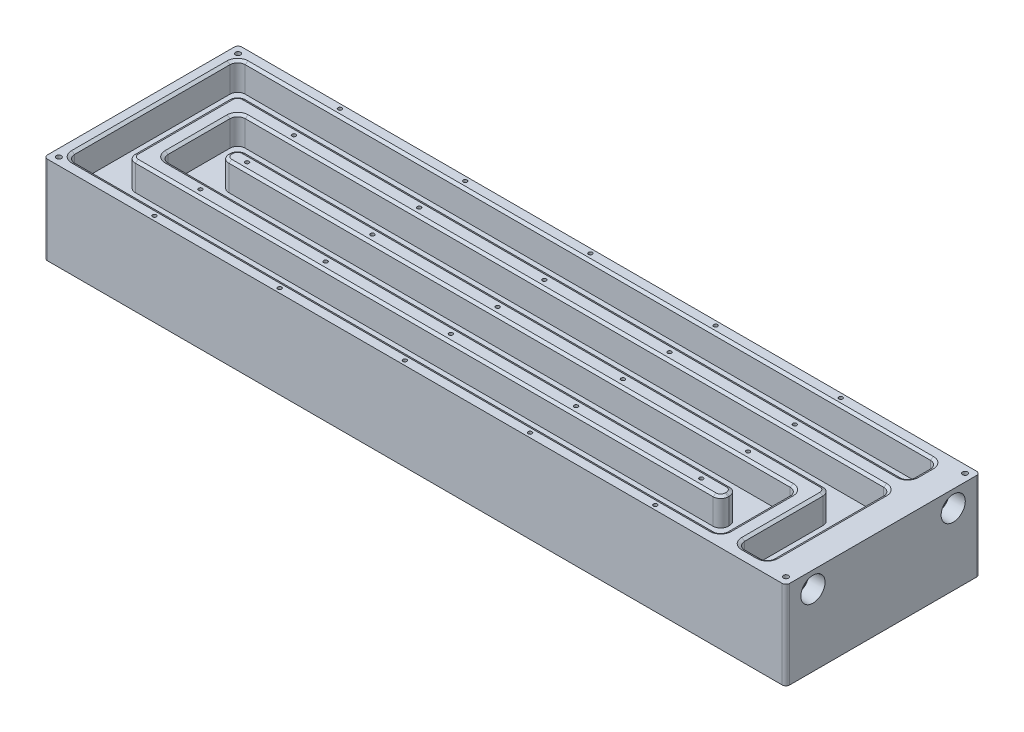
from build123d import *

# Parameters (mm, degrees)
SKETCH1_W                                  = 488.95
SKETCH1_H                                  = 134
BOSS_EXTRUDE1_DEPTH                        = 58
F_3_8_NPT_TAPPED_HOLE1_AT_2_COUNT          = 2
F_3_8_NPT_TAPPED_HOLE1_AT_2_PITCH          = 92.4
SKETCH4_W                                  = 461.45
SKETCH4_H                                  = 20
CUT_EXTRUDE1_DEPTH                         = 18
LPATTERN1_COUNT                            = 4
LPATTERN1_PITCH                            = 30.8
BOSS_EXTRUDE2_REACH                        = 262.04
SKETCH5_W                                  = 30.8
SKETCH5_H                                  = 20
BOSS_EXTRUDE3_REACH                        = 262.04
SKETCH6_W                                  = 30.8
SKETCH6_H                                  = 20
SKETCH7_W                                  = 20
SKETCH7_H                                  = 61.6
CUT_EXTRUDE2_DEPTH                         = 18
SKETCH8_W                                  = 20
SKETCH8_H                                  = 10.8
CUT_EXTRUDE3_DEPTH                         = 18
SKETCH9_W                                  = 20
SKETCH9_H                                  = 72.4
CUT_EXTRUDE4_DEPTH                         = 18
SKETCH10_W                                 = 20
SKETCH10_H                                 = 10.8
CUT_EXTRUDE5_DEPTH                         = 18
FILLET1_R                                  = 5
CHAMFER1_SIZE                              = 2
CHAMFER1_SIZE2                             = 1.154700538
TAP_DRILL_FOR_M3X0_5_PLATE_NEXT_MO_2_COUNT = 2
TAP_DRILL_FOR_M3X0_5_PLATE_NEXT_MO_2_PITCH = 61.6
LPATTERN2_COUNT                            = 5
LPATTERN2_PITCH                            = 97.75
SKETCH15_W                                 = 488.95
SKETCH15_H                                 = 3
CUT_EXTRUDE6_DEPTH                         = 261.040430751
SKETCH16_W                                 = 488.95
SKETCH16_H                                 = 3
CUT_EXTRUDE7_DEPTH                         = 261.040430751
FILLET2_R                                  = 2.5
TAP_DRILL_FOR_M3X0_5_TAP1_AT_2_COUNT       = 2
TAP_DRILL_FOR_M3X0_5_TAP1_AT_2_PITCH       = 30.8
TAP_DRILL_FOR_M3X0_5_TAP1_AT_3_COUNT       = 2
TAP_DRILL_FOR_M3X0_5_TAP1_AT_3_PITCH       = 61.1
TAP_DRILL_FOR_M3X0_5_TAP1_AT_4_COUNT       = 2
TAP_DRILL_FOR_M3X0_5_TAP1_AT_4_PITCH       = 30.8
TAP_DRILL_FOR_M3X0_5_TAP1_AT_5_COUNT       = 2
TAP_DRILL_FOR_M3X0_5_TAP1_AT_5_PITCH       = 61.1
LPATTERN3_COUNT                            = 5
LPATTERN3_PITCH                            = 82.5
TAP_DRILL_FOR_M4X0_7_TAP1_D                = 3.3
TAP_DRILL_FOR_M4X0_7_TAP1_DEPTH            = 17.38
TAP_DRILL_FOR_M4X0_7_TAP1_TIP              = 0.991420021


with BuildPart() as part:
    # Sketch1 → Boss-Extrude1 (new body)
    with BuildSketch(Plane(origin=(0, 0, 0), x_dir=(1, 0, 0), z_dir=(0, 1, 0))):
        Rectangle(SKETCH1_W, SKETCH1_H)
    extrude(amount=BOSS_EXTRUDE1_DEPTH)

    # Sketch3 → 3/8 NPT Tapped Hole1 (revolve, cut)
    with BuildSketch(Plane(origin=(244.475, 47, 46.2), x_dir=(0, 0, -1), z_dir=(0, 1, 0))):
        Polygon((0, 0), (0, 21.668582582), (7.1374, 17.38), (7.1374, 10.33), (7.653732966, 10.33), (7.963027, 0), align=None)
    f_3_8_npt_tapped_hole1 = revolve(axis=Axis((250.825, 47, 46.2), (-1, 0, 0)), mode=Mode.SUBTRACT)

    # 3/8 NPT Tapped Hole1 at 2: 3/8 NPT Tapped Hole1 ×2
    with Locations(*[(0, 0, -i * F_3_8_NPT_TAPPED_HOLE1_AT_2_PITCH) for i in range(1, F_3_8_NPT_TAPPED_HOLE1_AT_2_COUNT)]):
        add(f_3_8_npt_tapped_hole1, mode=Mode.SUBTRACT)

    # Sketch4 → Cut-Extrude1 (cut)
    with BuildSketch(Plane(origin=(0, 58, 0), x_dir=(1, 0, 0), z_dir=(0, 1, 0))):
        with Locations((-6.25, 46.2)):
            Rectangle(SKETCH4_W, SKETCH4_H)
    cut_extrude1 = extrude(amount=-CUT_EXTRUDE1_DEPTH, mode=Mode.SUBTRACT)

    # LPattern1: Cut-Extrude1 ×4
    with Locations(*[(0, 0, i * LPATTERN1_PITCH) for i in range(1, LPATTERN1_COUNT)]):
        add(cut_extrude1, mode=Mode.SUBTRACT)

    # Sketch5 → Boss-Extrude2 (add, up to next)
    with BuildSketch(Plane(origin=(0, 58, 0), x_dir=(1, 0, 0), z_dir=(0, 1, 0)), mode=Mode.PRIVATE) as boss_extrude2_sk1:
        with Locations((-221.575, -15.4)):
            Rectangle(SKETCH5_W, SKETCH5_H)
    boss_extrude2_tool1 = extrude(boss_extrude2_sk1.sketch, amount=-BOSS_EXTRUDE2_REACH, mode=Mode.PRIVATE) - part.part
    # Sketch5 → Boss-Extrude2 (add, up to next)
    with BuildSketch(Plane(origin=(0, 58, 0), x_dir=(1, 0, 0), z_dir=(0, 1, 0)), mode=Mode.PRIVATE) as boss_extrude2_sk2:
        with Locations((-221.575, 15.4)):
            Rectangle(SKETCH5_W, SKETCH5_H)
    boss_extrude2_tool2 = extrude(boss_extrude2_sk2.sketch, amount=-BOSS_EXTRUDE2_REACH, mode=Mode.PRIVATE) - part.part
    add(boss_extrude2_tool1.solids().sort_by_distance((-221.575, 58, 15.4))[0])
    add(boss_extrude2_tool2.solids().sort_by_distance((-221.575, 58, -15.4))[0])

    # Sketch6 → Boss-Extrude3 (add, up to next)
    with BuildSketch(Plane(origin=(0, 58, 0), x_dir=(1, 0, 0), z_dir=(0, 1, 0)), mode=Mode.PRIVATE) as boss_extrude3_sk1:
        with Locations((209.075, -46.2)):
            Rectangle(SKETCH6_W, SKETCH6_H)
    boss_extrude3_tool1 = extrude(boss_extrude3_sk1.sketch, amount=-BOSS_EXTRUDE3_REACH, mode=Mode.PRIVATE) - part.part
    # Sketch6 → Boss-Extrude3 (add, up to next)
    with BuildSketch(Plane(origin=(0, 58, 0), x_dir=(1, 0, 0), z_dir=(0, 1, 0)), mode=Mode.PRIVATE) as boss_extrude3_sk2:
        with Locations((209.075, -15.4)):
            Rectangle(SKETCH6_W, SKETCH6_H)
    boss_extrude3_tool2 = extrude(boss_extrude3_sk2.sketch, amount=-BOSS_EXTRUDE3_REACH, mode=Mode.PRIVATE) - part.part
    add(boss_extrude3_tool1.solids().sort_by_distance((209.075, 58, 46.2))[0])
    add(boss_extrude3_tool2.solids().sort_by_distance((209.075, 58, 15.4))[0])

    # Sketch7 → Cut-Extrude2 (cut)
    with BuildSketch(Plane(origin=(0, 58, 0), x_dir=(1, 0, 0), z_dir=(0, 1, 0))):
        with Locations((214.475, -25.4)):
            Rectangle(SKETCH7_W, SKETCH7_H)
    extrude(amount=-CUT_EXTRUDE2_DEPTH, mode=Mode.SUBTRACT)

    # Sketch8 → Cut-Extrude3 (cut)
    with BuildSketch(Plane(origin=(0, 58, 0), x_dir=(1, 0, 0), z_dir=(0, 1, 0))):
        with Locations((183.675, -30.8)):
            Rectangle(SKETCH8_W, SKETCH8_H)
    extrude(amount=-CUT_EXTRUDE3_DEPTH, mode=Mode.SUBTRACT)

    # Sketch9 → Cut-Extrude4 (cut)
    with BuildSketch(Plane(origin=(0, 58, 0), x_dir=(1, 0, 0), z_dir=(0, 1, 0))):
        with Locations((-226.975, 0)):
            Rectangle(SKETCH9_W, SKETCH9_H)
    extrude(amount=-CUT_EXTRUDE4_DEPTH, mode=Mode.SUBTRACT)

    # Sketch10 → Cut-Extrude5 (cut)
    with BuildSketch(Plane(origin=(0, 58, 0), x_dir=(1, 0, 0), z_dir=(0, 1, 0))):
        with Locations((-196.175, 0)):
            Rectangle(SKETCH10_W, SKETCH10_H)
    extrude(amount=-CUT_EXTRUDE5_DEPTH, mode=Mode.SUBTRACT)

    # Fillet1
    fillet1_edges = [part.edges().sort_by_distance(p)[0] for p in [
        (-206.175, 49, 25.4),
        (193.675, 49, 5.4),
        (193.675, 49, 56.2),
        (204.475, 49, 56.2),
        (204.475, 49, -5.4),
        (224.475, 49, 56.2),
        (173.675, 49, 36.2),
        (173.675, 49, 25.4),
        (-216.975, 49, -36.2),
        (-216.975, 49, 36.2),
        (-186.175, 49, -5.4),
        (-186.175, 49, 5.4),
        (224.475, 49, -56.2),
        (224.475, 49, -36.2),
        (-236.975, 49, -56.2),
        (224.475, 49, -25.4),
        (-236.975, 49, 56.2),
        (-206.175, 49, -25.4),
    ]]
    fillet(fillet1_edges, radius=FILLET1_R)

    # Chamfer1
    chamfer1_edges = [part.edges().sort_by_distance(p)[0] for p in [
        (3.75, 58, 5.4),
        (193.675, 58, 30.8),
        (173.675, 58, 30.8),
        (-16.25, 58, 25.4),
        (-206.175, 58, 0),
        (9.15, 58, -25.4),
        (224.475, 58, 15.4),
        (214.475, 58, 56.2),
        (204.475, 58, 25.4),
        (9.15, 58, -5.4),
        (-186.175, 58, 0),
        (-21.65, 58, 56.2),
        (-236.975, 58, 0),
        (-6.25, 58, -56.2),
        (224.475, 58, -46.2),
        (3.75, 58, -36.2),
        (-216.975, 58, 0),
        (-21.65, 58, 36.2),
        (-184.710533906, 58, 3.935533906),
        (-184.710533906, 58, -3.935533906),
        (-215.510533906, 58, 34.735533906),
        (-215.510533906, 58, -34.735533906),
        (203.010533906, 58, -3.935533906),
        (172.210533906, 58, 34.735533906),
        (172.210533906, 58, 26.864466094),
        (192.210533906, 58, 6.864466094),
        (192.210533906, 58, 54.735533906),
        (205.939466094, 58, 54.735533906),
        (223.010533906, 58, 54.735533906),
        (223.010533906, 58, -23.935533906),
        (223.010533906, 58, -37.664466094),
        (223.010533906, 58, -54.735533906),
        (-235.510533906, 58, 54.735533906),
        (-204.710533906, 58, 23.935533906),
        (-204.710533906, 58, -23.935533906),
        (-235.510533906, 58, -54.735533906),
    ]]
    chamfer1_side = [part.faces().sort_by_distance(p)[0] for p in [
        (10.260026079, 58, -0.000428348),
    ]]
    chamfer(chamfer1_edges, length=CHAMFER1_SIZE, length2=CHAMFER1_SIZE2, reference=chamfer1_side[0])

    # Sketch14 → Tap Drill for M3x0.5 - Plate Next Mounts (revolve, cut)
    with BuildSketch(Plane(origin=(-191.975, 0, 30.8), x_dir=(0, 0, -1), z_dir=(1, 0, 0))):
        Polygon((0, 0), (0, 10.751075774), (1.25, 10), (1.25, 0), align=None)
    tap_drill_for_m3x0_5_plate_next_mounts = revolve(axis=Axis((-191.975, -6.35, 30.8), (0, 1, 0)), mode=Mode.SUBTRACT)

    # Tap Drill for M3x0.5 - Plate Next Mo 2: Tap Drill for M3x0.5 - Plate Next Mounts ×2
    with Locations(*[(0, 0, -i * TAP_DRILL_FOR_M3X0_5_PLATE_NEXT_MO_2_PITCH) for i in range(1, TAP_DRILL_FOR_M3X0_5_PLATE_NEXT_MO_2_COUNT)]):
        add(tap_drill_for_m3x0_5_plate_next_mounts, mode=Mode.SUBTRACT)

    # LPattern2: Tap Drill for M3x0.5 - Plate Next Mounts ×5
    with Locations(*[(i * LPATTERN2_PITCH, 0, 0) for i in range(1, LPATTERN2_COUNT)]):
        add(tap_drill_for_m3x0_5_plate_next_mounts, mode=Mode.SUBTRACT)

    # LPattern2 copy 1 sketch → LPattern2 copy 1 (revolve, cut)
    with BuildSketch(Plane(origin=(-94.225, 0, -30.8), x_dir=(0, 0, -1), z_dir=(1, 0, 0))):
        Polygon((0, 0), (0, 10.751075774), (1.25, 10), (1.25, 0), align=None)
    revolve(axis=Axis((-94.225, -6.35, -30.8), (0, 1, 0)), mode=Mode.SUBTRACT)

    # LPattern2 copy 2 sketch → LPattern2 copy 2 (revolve, cut)
    with BuildSketch(Plane(origin=(3.525, 0, -30.8), x_dir=(0, 0, -1), z_dir=(1, 0, 0))):
        Polygon((0, 0), (0, 10.751075774), (1.25, 10), (1.25, 0), align=None)
    revolve(axis=Axis((3.525, -6.35, -30.8), (0, 1, 0)), mode=Mode.SUBTRACT)

    # LPattern2 copy 3 sketch → LPattern2 copy 3 (revolve, cut)
    with BuildSketch(Plane(origin=(101.275, 0, -30.8), x_dir=(0, 0, -1), z_dir=(1, 0, 0))):
        Polygon((0, 0), (0, 10.751075774), (1.25, 10), (1.25, 0), align=None)
    revolve(axis=Axis((101.275, -6.35, -30.8), (0, 1, 0)), mode=Mode.SUBTRACT)

    # LPattern2 copy 4 sketch → LPattern2 copy 4 (revolve, cut)
    with BuildSketch(Plane(origin=(199.025, 0, -30.8), x_dir=(0, 0, -1), z_dir=(1, 0, 0))):
        Polygon((0, 0), (0, 10.751075774), (1.25, 10), (1.25, 0), align=None)
    revolve(axis=Axis((199.025, -6.35, -30.8), (0, 1, 0)), mode=Mode.SUBTRACT)

    # Sketch15 → Cut-Extrude6 (cut, through all)
    with BuildSketch(Plane(origin=(0, 58, 0), x_dir=(1, 0, 0), z_dir=(0, 1, 0))):
        with Locations((0, -65.5)):
            Rectangle(SKETCH15_W, SKETCH15_H)
    extrude(amount=-CUT_EXTRUDE6_DEPTH, mode=Mode.SUBTRACT)

    # Sketch16 → Cut-Extrude7 (cut, through all)
    with BuildSketch(Plane(origin=(0, 58, 0), x_dir=(1, 0, 0), z_dir=(0, 1, 0))):
        with Locations((0, 65.5)):
            Rectangle(SKETCH16_W, SKETCH16_H)
    extrude(amount=-CUT_EXTRUDE7_DEPTH, mode=Mode.SUBTRACT)

    # Fillet2
    fillet2_edges = [part.edges().sort_by_distance(p)[0] for p in [
        (244.475, 29, 64),
        (-244.475, 29, 64),
        (244.475, 29, -64),
        (-244.475, 29, -64),
    ]]
    fillet(fillet2_edges, radius=FILLET2_R)

    # Sketch12 → Tap Drill for M3x0.5 Tap1 (revolve, cut)
    with BuildSketch(Plane(origin=(-174.475, 58, 0), x_dir=(0, 0, 1), z_dir=(1, 0, 0))):
        Polygon((0, 0), (0, 10.751075774), (1.25, 10), (1.25, 0), align=None)
    tap_drill_for_m3x0_5_tap1 = revolve(axis=Axis((-174.475, 64.35, 0), (0, -1, 0)), mode=Mode.SUBTRACT)

    # Tap Drill for M3x0.5 Tap1 at 2: Tap Drill for M3x0.5 Tap1 ×2
    with Locations(*[(0, 0, i * TAP_DRILL_FOR_M3X0_5_TAP1_AT_2_PITCH) for i in range(1, TAP_DRILL_FOR_M3X0_5_TAP1_AT_2_COUNT)]):
        add(tap_drill_for_m3x0_5_tap1, mode=Mode.SUBTRACT)

    # Tap Drill for M3x0.5 Tap1 at 3: Tap Drill for M3x0.5 Tap1 ×2
    with Locations(*[(0, 0, i * TAP_DRILL_FOR_M3X0_5_TAP1_AT_3_PITCH) for i in range(1, TAP_DRILL_FOR_M3X0_5_TAP1_AT_3_COUNT)]):
        add(tap_drill_for_m3x0_5_tap1, mode=Mode.SUBTRACT)

    # Tap Drill for M3x0.5 Tap1 at 4: Tap Drill for M3x0.5 Tap1 ×2
    with Locations(*[(0, 0, -i * TAP_DRILL_FOR_M3X0_5_TAP1_AT_4_PITCH) for i in range(1, TAP_DRILL_FOR_M3X0_5_TAP1_AT_4_COUNT)]):
        add(tap_drill_for_m3x0_5_tap1, mode=Mode.SUBTRACT)

    # Tap Drill for M3x0.5 Tap1 at 5: Tap Drill for M3x0.5 Tap1 ×2
    with Locations(*[(0, 0, -i * TAP_DRILL_FOR_M3X0_5_TAP1_AT_5_PITCH) for i in range(1, TAP_DRILL_FOR_M3X0_5_TAP1_AT_5_COUNT)]):
        add(tap_drill_for_m3x0_5_tap1, mode=Mode.SUBTRACT)

    # LPattern3: Tap Drill for M3x0.5 Tap1 ×5
    with Locations(*[(i * LPATTERN3_PITCH, 0, 0) for i in range(1, LPATTERN3_COUNT)]):
        add(tap_drill_for_m3x0_5_tap1, mode=Mode.SUBTRACT)

    # LPattern3 copy 1 sketch → LPattern3 copy 1 (revolve, cut)
    with BuildSketch(Plane(origin=(-91.975, 58, 30.8), x_dir=(0, 0, 1), z_dir=(1, 0, 0))):
        Polygon((0, 0), (0, 10.751075774), (1.25, 10), (1.25, 0), align=None)
    revolve(axis=Axis((-91.975, 64.35, 30.8), (0, -1, 0)), mode=Mode.SUBTRACT)

    # LPattern3 copy 2 sketch → LPattern3 copy 2 (revolve, cut)
    with BuildSketch(Plane(origin=(-9.475, 58, 30.8), x_dir=(0, 0, 1), z_dir=(1, 0, 0))):
        Polygon((0, 0), (0, 10.751075774), (1.25, 10), (1.25, 0), align=None)
    revolve(axis=Axis((-9.475, 64.35, 30.8), (0, -1, 0)), mode=Mode.SUBTRACT)

    # LPattern3 copy 3 sketch → LPattern3 copy 3 (revolve, cut)
    with BuildSketch(Plane(origin=(73.025, 58, 30.8), x_dir=(0, 0, 1), z_dir=(1, 0, 0))):
        Polygon((0, 0), (0, 10.751075774), (1.25, 10), (1.25, 0), align=None)
    revolve(axis=Axis((73.025, 64.35, 30.8), (0, -1, 0)), mode=Mode.SUBTRACT)

    # LPattern3 copy 4 sketch → LPattern3 copy 4 (revolve, cut)
    with BuildSketch(Plane(origin=(155.525, 58, 30.8), x_dir=(0, 0, 1), z_dir=(1, 0, 0))):
        Polygon((0, 0), (0, 10.751075774), (1.25, 10), (1.25, 0), align=None)
    revolve(axis=Axis((155.525, 64.35, 30.8), (0, -1, 0)), mode=Mode.SUBTRACT)

    # LPattern3 copy 5 sketch → LPattern3 copy 5 (revolve, cut)
    with BuildSketch(Plane(origin=(-91.975, 58, 61.1), x_dir=(0, 0, 1), z_dir=(1, 0, 0))):
        Polygon((0, 0), (0, 10.751075774), (1.25, 10), (1.25, 0), align=None)
    revolve(axis=Axis((-91.975, 64.35, 61.1), (0, -1, 0)), mode=Mode.SUBTRACT)

    # LPattern3 copy 6 sketch → LPattern3 copy 6 (revolve, cut)
    with BuildSketch(Plane(origin=(-9.475, 58, 61.1), x_dir=(0, 0, 1), z_dir=(1, 0, 0))):
        Polygon((0, 0), (0, 10.751075774), (1.25, 10), (1.25, 0), align=None)
    revolve(axis=Axis((-9.475, 64.35, 61.1), (0, -1, 0)), mode=Mode.SUBTRACT)

    # LPattern3 copy 7 sketch → LPattern3 copy 7 (revolve, cut)
    with BuildSketch(Plane(origin=(73.025, 58, 61.1), x_dir=(0, 0, 1), z_dir=(1, 0, 0))):
        Polygon((0, 0), (0, 10.751075774), (1.25, 10), (1.25, 0), align=None)
    revolve(axis=Axis((73.025, 64.35, 61.1), (0, -1, 0)), mode=Mode.SUBTRACT)

    # LPattern3 copy 8 sketch → LPattern3 copy 8 (revolve, cut)
    with BuildSketch(Plane(origin=(155.525, 58, 61.1), x_dir=(0, 0, 1), z_dir=(1, 0, 0))):
        Polygon((0, 0), (0, 10.751075774), (1.25, 10), (1.25, 0), align=None)
    revolve(axis=Axis((155.525, 64.35, 61.1), (0, -1, 0)), mode=Mode.SUBTRACT)

    # LPattern3 copy 9 sketch → LPattern3 copy 9 (revolve, cut)
    with BuildSketch(Plane(origin=(-91.975, 58, -30.8), x_dir=(0, 0, 1), z_dir=(1, 0, 0))):
        Polygon((0, 0), (0, 10.751075774), (1.25, 10), (1.25, 0), align=None)
    revolve(axis=Axis((-91.975, 64.35, -30.8), (0, -1, 0)), mode=Mode.SUBTRACT)

    # LPattern3 copy 10 sketch → LPattern3 copy 10 (revolve, cut)
    with BuildSketch(Plane(origin=(-9.475, 58, -30.8), x_dir=(0, 0, 1), z_dir=(1, 0, 0))):
        Polygon((0, 0), (0, 10.751075774), (1.25, 10), (1.25, 0), align=None)
    revolve(axis=Axis((-9.475, 64.35, -30.8), (0, -1, 0)), mode=Mode.SUBTRACT)

    # LPattern3 copy 11 sketch → LPattern3 copy 11 (revolve, cut)
    with BuildSketch(Plane(origin=(73.025, 58, -30.8), x_dir=(0, 0, 1), z_dir=(1, 0, 0))):
        Polygon((0, 0), (0, 10.751075774), (1.25, 10), (1.25, 0), align=None)
    revolve(axis=Axis((73.025, 64.35, -30.8), (0, -1, 0)), mode=Mode.SUBTRACT)

    # LPattern3 copy 12 sketch → LPattern3 copy 12 (revolve, cut)
    with BuildSketch(Plane(origin=(155.525, 58, -30.8), x_dir=(0, 0, 1), z_dir=(1, 0, 0))):
        Polygon((0, 0), (0, 10.751075774), (1.25, 10), (1.25, 0), align=None)
    revolve(axis=Axis((155.525, 64.35, -30.8), (0, -1, 0)), mode=Mode.SUBTRACT)

    # LPattern3 copy 13 sketch → LPattern3 copy 13 (revolve, cut)
    with BuildSketch(Plane(origin=(-91.975, 58, -61.1), x_dir=(0, 0, 1), z_dir=(1, 0, 0))):
        Polygon((0, 0), (0, 10.751075774), (1.25, 10), (1.25, 0), align=None)
    revolve(axis=Axis((-91.975, 64.35, -61.1), (0, -1, 0)), mode=Mode.SUBTRACT)

    # LPattern3 copy 14 sketch → LPattern3 copy 14 (revolve, cut)
    with BuildSketch(Plane(origin=(-9.475, 58, -61.1), x_dir=(0, 0, 1), z_dir=(1, 0, 0))):
        Polygon((0, 0), (0, 10.751075774), (1.25, 10), (1.25, 0), align=None)
    revolve(axis=Axis((-9.475, 64.35, -61.1), (0, -1, 0)), mode=Mode.SUBTRACT)

    # LPattern3 copy 15 sketch → LPattern3 copy 15 (revolve, cut)
    with BuildSketch(Plane(origin=(73.025, 58, -61.1), x_dir=(0, 0, 1), z_dir=(1, 0, 0))):
        Polygon((0, 0), (0, 10.751075774), (1.25, 10), (1.25, 0), align=None)
    revolve(axis=Axis((73.025, 64.35, -61.1), (0, -1, 0)), mode=Mode.SUBTRACT)

    # LPattern3 copy 16 sketch → LPattern3 copy 16 (revolve, cut)
    with BuildSketch(Plane(origin=(155.525, 58, -61.1), x_dir=(0, 0, 1), z_dir=(1, 0, 0))):
        Polygon((0, 0), (0, 10.751075774), (1.25, 10), (1.25, 0), align=None)
    revolve(axis=Axis((155.525, 64.35, -61.1), (0, -1, 0)), mode=Mode.SUBTRACT)

    # Tap Drill for M4x0.7 Tap1
    with Locations(Plane(origin=(0, 58, 0), x_dir=(1, 0, 0), z_dir=(0, 1, 0))):
        with Locations((239.475, -59), (239.475, 59), (-239.475, 59), (-239.475, -59)):
            Hole(TAP_DRILL_FOR_M4X0_7_TAP1_D / 2, depth=TAP_DRILL_FOR_M4X0_7_TAP1_DEPTH)
            with Locations((0, 0, -(TAP_DRILL_FOR_M4X0_7_TAP1_DEPTH + TAP_DRILL_FOR_M4X0_7_TAP1_TIP / 2))):  # 118° drill point
                Cone(0, TAP_DRILL_FOR_M4X0_7_TAP1_D / 2, TAP_DRILL_FOR_M4X0_7_TAP1_TIP, mode=Mode.SUBTRACT)


solid = part.part
